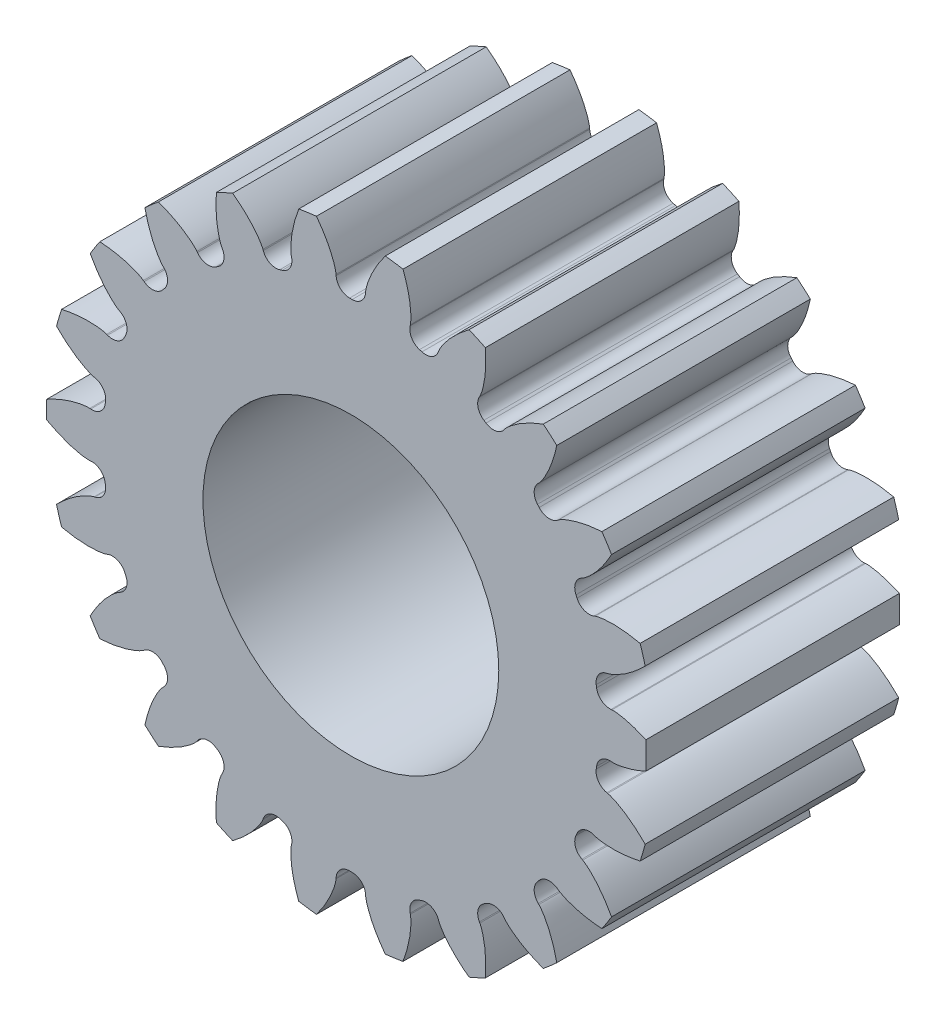
from build123d import *

# Parameters (mm, degrees)
SKETCH1_R           = 17.5
BOSS_EXTRUDE1_DEPTH = 15


with BuildPart() as part:
    # Sketch1 → Boss-Extrude1 (new, symmetric)
    with BuildSketch(Plane.XY):
        with BuildLine():
            Line((-819.999999996, 933.891939604), (-819.999999996, 937.108060409))
            add(Edge.make_bspline(
                [(-819.999999996, 937.108060409), (-820.169210713, 937.18620957), (-820.396536315, 937.28721849), (-820.682528966, 937.407460547), (-821.042316183, 937.547769893), (-821.447510434, 937.689348826), (-821.710754679, 937.774392828), (-821.974540013, 937.852893107), (-822.194762677, 937.912930565), (-822.400539325, 937.965293736), (-822.577110988, 938.006053443), (-822.783274591, 938.049036845), (-822.945371198, 938.079901437), (-823.122277747, 938.109838066), (-823.284458602, 938.132727377), (-823.446614921, 938.149965464), (-823.608736025, 938.164972712), (-823.756009483, 938.177018165), (-823.873604266, 938.180526415), (-823.946961903, 938.177999707), (-824.005559029, 938.17296028)],
                knots=[0, 0, 0, 0, 0, 0, 0.168282354, 0.225425211, 0.282568068, 0.35399664, 0.396853783, 0.425425211, 0.482568068, 0.496853783, 0.55399664, 0.568282354, 0.625425211, 0.639710926, 0.668282354, 0.711139497, 0.725425211, 0.782568068, 0.782568068, 0.782568068, 0.782568068, 0.782568068, 0.782568068], degree=5, weights=[1, 1, 1, 1, 1, 1, 1, 1, 1, 1, 1, 1, 1, 1, 1, 1, 1, 1, 1, 1, 1]))
            Line((-824.005559029, 938.17296028), (-824.119870347, 938.163129363))
            ThreePointArc((-824.119870347, 938.163129363), (-825.246284775, 938.504111809), (-825.828380871, 939.526971833))
            ThreePointArc((-825.828380871, 939.526971833), (-825.849532533, 939.676826658), (-825.871456644, 939.826570421))
            ThreePointArc((-825.871456644, 939.826570421), (-825.601112501, 940.971992849), (-824.616391628, 941.616510727))
            Line((-824.616391628, 941.616510727), (-824.503941032, 941.639283251))
            add(Edge.make_bspline(
                [(-824.503941032, 941.639283251), (-824.446297731, 941.650956674), (-824.375199737, 941.66919955), (-824.277336536, 941.701131741), (-824.153002371, 941.748044847), (-824.0153884, 941.802437657), (-823.878105187, 941.85808966), (-823.741846055, 941.917340589), (-823.579916832, 941.993836635), (-823.419360272, 942.074827636), (-823.233259117, 942.172958266), (-823.048550255, 942.275278574), (-822.852685758, 942.390889117), (-822.658298212, 942.510542894), (-822.414306529, 942.668029809), (-822.147773547, 942.850237651), (-821.871857627, 943.049172255), (-821.550473027, 943.295251308), (-821.222004423, 943.5623757), (-820.910593535, 943.829870846), (-820.615861133, 944.096394198), (-820.383677932, 944.316496637), (-820.222936403, 944.473775473), (-820.120333974, 944.576209821), (-820.074877498, 944.621997763)],
                knots=[0, 0, 0, 0, 0, 0, 0.057142857, 0.071428571, 0.1, 0.128571429, 0.142857143, 0.2, 0.214285714, 0.271428571, 0.3, 0.342857143, 0.4, 0.428571429, 0.485714286, 0.571428571, 0.642857143, 0.714285714, 0.8, 0.871428571, 0.942857143, 1, 1, 1, 1, 1, 1], degree=5, weights=[1, 1, 1, 1, 1, 1, 1, 1, 1, 1, 1, 1, 1, 1, 1, 1, 1, 1, 1, 1, 1, 1, 1, 1, 1]))
            ThreePointArc((-820.074877498, 944.621997763), (-820.358252945, 945.642372053), (-820.67151834, 946.653969862))
            add(Edge.make_bspline(
                [(-820.67151834, 946.653969862), (-820.876252904, 946.699286697), (-821.143709734, 946.754428002), (-821.473693826, 946.815895787), (-821.881249653, 946.881381654), (-822.365326499, 946.943221003), (-822.707760636, 946.978846565), (-823.064446223, 947.007227068), (-823.404017907, 947.024906882), (-823.695923105, 947.032754982), (-823.971138968, 947.033758391), (-824.199355734, 947.029320073), (-824.411549328, 947.021588164), (-824.592451955, 947.010950837), (-824.802374298, 946.994110107), (-824.966600417, 946.978056576), (-825.14477513, 946.956940227), (-825.306835185, 946.933210733), (-825.467279565, 946.904065842), (-825.627061654, 946.872790397), (-825.771763099, 946.842856197), (-825.885582855, 946.81309206), (-825.955257137, 946.790000466), (-826.010060896, 946.768656454)],
                knots=[0, 0, 0, 0, 0, 0, 0.185714286, 0.242857143, 0.3, 0.371428571, 0.442857143, 0.5, 0.571428571, 0.614285714, 0.642857143, 0.7, 0.714285714, 0.771428571, 0.785714286, 0.842857143, 0.857142857, 0.885714286, 0.928571429, 0.942857143, 1, 1, 1, 1, 1, 1], degree=5, weights=[1, 1, 1, 1, 1, 1, 1, 1, 1, 1, 1, 1, 1, 1, 1, 1, 1, 1, 1, 1, 1, 1, 1, 1]))
            Line((-826.010060896, 946.768656454), (-826.116972113, 946.727018538))
            ThreePointArc((-826.116972113, 946.727018538), (-827.293824699, 946.736841182), (-828.140514783, 947.554272767))
            ThreePointArc((-828.140514783, 947.554272767), (-828.203028637, 947.692098306), (-828.266252361, 947.829599659))
            ThreePointArc((-828.266252361, 947.829599659), (-828.329561844, 949.004789177), (-827.566310755, 949.900627482))
            Line((-827.566310755, 949.900627482), (-827.46483096, 949.954158552))
            add(Edge.make_bspline(
                [(-827.46483096, 949.954158552), (-827.412811402, 949.981599114), (-827.349732988, 950.019133645), (-827.264830271, 950.077343608), (-827.158749464, 950.157385386), (-827.042034051, 950.248345241), (-826.925990753, 950.340420097), (-826.811943989, 950.43565958), (-826.678125464, 950.554677734), (-826.546890374, 950.67762204), (-826.395974217, 950.824208444), (-826.247574324, 950.974422561), (-826.09221497, 951.14053147), (-825.93941185, 951.310103728), (-825.749672735, 951.529951717), (-825.545270093, 951.779869881), (-825.336577061, 952.048480733), (-825.097539276, 952.37513636), (-824.857633596, 952.723980637), (-824.634199129, 953.068374936), (-824.426493766, 953.407137933), (-824.265725639, 953.683738243), (-824.155805839, 953.879932303), (-824.086218621, 954.007123785), (-824.055503406, 954.063863562)],
                knots=[0, 0, 0, 0, 0, 0, 0.057142857, 0.071428571, 0.1, 0.128571429, 0.142857143, 0.2, 0.214285714, 0.271428571, 0.3, 0.342857143, 0.4, 0.428571429, 0.485714286, 0.571428571, 0.642857143, 0.714285714, 0.8, 0.871428571, 0.942857143, 1, 1, 1, 1, 1, 1], degree=5, weights=[1, 1, 1, 1, 1, 1, 1, 1, 1, 1, 1, 1, 1, 1, 1, 1, 1, 1, 1, 1, 1, 1, 1, 1, 1]))
            ThreePointArc((-824.055503406, 954.063863562), (-824.614872814, 954.963069435), (-825.200448796, 955.845433365))
            add(Edge.make_bspline(
                [(-825.200448796, 955.845433365), (-825.409657399, 955.831234156), (-825.681815449, 955.808790556), (-826.015750343, 955.774801201), (-826.425246796, 955.722812685), (-826.907137287, 955.645766899), (-827.245737316, 955.58347453), (-827.595970342, 955.510215481), (-827.926767966, 955.431510739), (-828.209060018, 955.356801738), (-828.473410398, 955.280227234), (-828.691132362, 955.211672605), (-828.892552294, 955.144472049), (-829.063130212, 955.08329945), (-829.259804644, 955.007998929), (-829.412855649, 954.946327834), (-829.577863871, 954.875869228), (-829.726673983, 954.807443351), (-829.872408174, 954.734276628), (-830.016906655, 954.659252242), (-830.147313236, 954.589763479), (-830.248136966, 954.529138268), (-830.308483296, 954.487352532), (-830.355053815, 954.451433099)],
                knots=[0, 0, 0, 0, 0, 0, 0.185714286, 0.242857143, 0.3, 0.371428571, 0.442857143, 0.5, 0.571428571, 0.614285714, 0.642857143, 0.7, 0.714285714, 0.771428571, 0.785714286, 0.842857143, 0.857142857, 0.885714286, 0.928571429, 0.942857143, 1, 1, 1, 1, 1, 1], degree=5, weights=[1, 1, 1, 1, 1, 1, 1, 1, 1, 1, 1, 1, 1, 1, 1, 1, 1, 1, 1, 1, 1, 1, 1, 1]))
            Line((-830.355053815, 954.451433099), (-830.44590362, 954.381361441))
            ThreePointArc((-830.44590362, 954.381361441), (-831.577852766, 954.059228511), (-832.620543042, 954.605008211))
            ThreePointArc((-832.620543042, 954.605008211), (-832.719354588, 954.719638659), (-832.818755914, 954.83375806))
            ThreePointArc((-832.818755914, 954.83375806), (-833.210590066, 955.943507802), (-832.730642825, 957.018091042))
            Line((-832.730642825, 957.018091042), (-832.64835512, 957.09804389))
            add(Edge.make_bspline(
                [(-832.64835512, 957.09804389), (-832.606173619, 957.13902852), (-832.556225024, 957.192813882), (-832.491161105, 957.272585791), (-832.41192769, 957.379271732), (-832.325566424, 957.499429606), (-832.24016418, 957.620467957), (-832.157569175, 957.743980259), (-832.062702529, 957.895878377), (-831.971420796, 958.050815772), (-831.867915966, 958.233982392), (-831.767847519, 958.419920862), (-831.665579597, 958.623070982), (-831.566740103, 958.828823986), (-831.446625092, 959.093222272), (-831.320912276, 959.390603873), (-831.196349201, 959.707129719), (-831.05902365, 960.087898225), (-830.927116627, 960.490201099), (-830.809759911, 960.883593772), (-830.70590864, 961.26715185), (-830.629580065, 961.57784152), (-830.579387043, 961.797056328), (-830.548452578, 961.938700647), (-830.534966987, 962.00179554)],
                knots=[0, 0, 0, 0, 0, 0, 0.057142857, 0.071428571, 0.1, 0.128571429, 0.142857143, 0.2, 0.214285714, 0.271428571, 0.3, 0.342857143, 0.4, 0.428571429, 0.485714286, 0.571428571, 0.642857143, 0.714285714, 0.8, 0.871428571, 0.942857143, 1, 1, 1, 1, 1, 1], degree=5, weights=[1, 1, 1, 1, 1, 1, 1, 1, 1, 1, 1, 1, 1, 1, 1, 1, 1, 1, 1, 1, 1, 1, 1, 1, 1]))
            ThreePointArc((-830.534966987, 962.00179554), (-831.325013574, 962.706984683), (-832.13546026, 963.388630855))
            add(Edge.make_bspline(
                [(-832.13546026, 963.388630855), (-832.332194066, 963.31606594), (-832.587004709, 963.217855679), (-832.897836986, 963.091162801), (-833.276099098, 962.925911702), (-833.716763331, 962.716222572), (-834.024097892, 962.561058829), (-834.33950456, 962.392095241), (-834.634728868, 962.223382134), (-834.884538151, 962.072168511), (-835.116606951, 961.924219703), (-835.306195575, 961.797102654), (-835.480524, 961.67587764), (-835.626958002, 961.569125607), (-835.794451129, 961.441465696), (-835.923927737, 961.339173263), (-836.062401484, 961.225080537), (-836.185905944, 961.117501736), (-836.305123428, 961.006240713), (-836.422631893, 960.893545415), (-836.528178845, 960.790131656), (-836.607838409, 960.703556864), (-836.653967886, 960.646462219), (-836.688532298, 960.598877344)],
                knots=[0, 0, 0, 0, 0, 0, 0.185714286, 0.242857143, 0.3, 0.371428571, 0.442857143, 0.5, 0.571428571, 0.614285714, 0.642857143, 0.7, 0.714285714, 0.771428571, 0.785714286, 0.842857143, 0.857142857, 0.885714286, 0.928571429, 0.942857143, 1, 1, 1, 1, 1, 1], degree=5, weights=[1, 1, 1, 1, 1, 1, 1, 1, 1, 1, 1, 1, 1, 1, 1, 1, 1, 1, 1, 1, 1, 1, 1, 1]))
            Line((-836.688532298, 960.598877344), (-836.75596058, 960.506048732))
            ThreePointArc((-836.75596058, 960.506048732), (-837.751302498, 959.878057522), (-838.905520403, 960.107969512))
            ThreePointArc((-838.905520403, 960.107969512), (-839.032624516, 960.190118192), (-839.160150541, 960.271610365))
            ThreePointArc((-839.160150541, 960.271610365), (-839.848765289, 961.226015008), (-839.691004367, 962.39228684))
            Line((-839.691004367, 962.39228684), (-839.634575212, 962.492184162))
            add(Edge.make_bspline(
                [(-839.634575212, 962.492184162), (-839.605649063, 962.543392528), (-839.572876824, 962.60907135), (-839.532922796, 962.703942561), (-839.486955794, 962.828629604), (-839.437945151, 962.96825102), (-839.390102742, 963.10844706), (-839.345650851, 963.250225948), (-839.297421616, 963.422698147), (-839.253488343, 963.597076525), (-839.205780186, 963.80198429), (-839.162150135, 964.008583486), (-839.121258785, 964.232316801), (-839.084390305, 964.457581666), (-839.043630401, 964.745110274), (-839.006791916, 965.065863223), (-838.976450157, 965.404661022), (-838.951962141, 965.808694807), (-838.938740096, 966.23186409), (-838.936968675, 966.642384803), (-838.945384909, 967.039664369), (-838.959679572, 967.359273168), (-838.973279669, 967.583749245), (-838.983504083, 967.728371219), (-838.988340639, 967.792709656)],
                knots=[0, 0, 0, 0, 0, 0, 0.057142857, 0.071428571, 0.1, 0.128571429, 0.142857143, 0.2, 0.214285714, 0.271428571, 0.3, 0.342857143, 0.4, 0.428571429, 0.485714286, 0.571428571, 0.642857143, 0.714285714, 0.8, 0.871428571, 0.942857143, 1, 1, 1, 1, 1, 1], degree=5, weights=[1, 1, 1, 1, 1, 1, 1, 1, 1, 1, 1, 1, 1, 1, 1, 1, 1, 1, 1, 1, 1, 1, 1, 1, 1]))
            ThreePointArc((-838.988340639, 967.792709656), (-839.945059527, 968.246751839), (-840.914719348, 968.672457335))
            add(Edge.make_bspline(
                [(-840.914719348, 968.672457335), (-841.083040153, 968.54740549), (-841.299860147, 968.381384981), (-841.562408024, 968.172252482), (-841.878791247, 967.907126462), (-842.242529229, 967.581781754), (-842.493699902, 967.346317082), (-842.74872784, 967.095337379), (-842.984461514, 966.850284039), (-843.181549965, 966.634816222), (-843.362536353, 966.427479044), (-843.508632294, 966.25209784), (-843.64174616, 966.086669298), (-843.752173032, 965.942986248), (-843.876915558, 965.773309193), (-843.972328345, 965.638682546), (-844.073049296, 965.490198815), (-844.161242508, 965.352182484), (-844.244284993, 965.211840867), (-844.325283606, 965.07060456), (-844.397420141, 964.941643772), (-844.449461996, 964.836133176), (-844.477637485, 964.768355089), (-844.497395587, 964.712959815)],
                knots=[0, 0, 0, 0, 0, 0, 0.185714286, 0.242857143, 0.3, 0.371428571, 0.442857143, 0.5, 0.571428571, 0.614285714, 0.642857143, 0.7, 0.714285714, 0.771428571, 0.785714286, 0.842857143, 0.857142857, 0.885714286, 0.928571429, 0.942857143, 1, 1, 1, 1, 1, 1], degree=5, weights=[1, 1, 1, 1, 1, 1, 1, 1, 1, 1, 1, 1, 1, 1, 1, 1, 1, 1, 1, 1, 1, 1, 1, 1]))
            Line((-844.497395587, 964.712959815), (-844.535939708, 964.604894673))
            ThreePointArc((-844.535939708, 964.604894673), (-845.314037715, 963.721921295), (-846.486275377, 963.617339473))
            ThreePointArc((-846.486275377, 963.617339473), (-846.631374838, 963.660351188), (-846.776694161, 963.702614122))
            ThreePointArc((-846.776694161, 963.702614122), (-847.706302034, 964.424353477), (-847.883508283, 965.587829493))
            Line((-847.883508283, 965.587829493), (-847.857509234, 965.699578201))
            add(Edge.make_bspline(
                [(-847.857509234, 965.699578201), (-847.844181861, 965.756861707), (-847.83124099, 965.829113082), (-847.819633689, 965.931397692), (-847.810657073, 966.063984435), (-847.802967604, 966.211758097), (-847.796560938, 966.359753977), (-847.79385339, 966.508313368), (-847.796168811, 966.687386977), (-847.803143211, 966.867079239), (-847.815096758, 967.077127741), (-847.83143975, 967.287650223), (-847.855237746, 967.513841191), (-847.883327145, 967.740368298), (-847.925224474, 968.027733368), (-847.980244755, 968.34587217), (-848.04658242, 968.679494539), (-848.136915812, 969.074061188), (-848.243449916, 969.483814223), (-848.357407301, 969.878205029), (-848.477409206, 970.257020854), (-848.581169039, 970.559655979), (-848.657460455, 970.771207608), (-848.708015427, 970.907090826), (-848.730782301, 970.967460488)],
                knots=[0, 0, 0, 0, 0, 0, 0.057142857, 0.071428571, 0.1, 0.128571429, 0.142857143, 0.2, 0.214285714, 0.271428571, 0.3, 0.342857143, 0.4, 0.428571429, 0.485714286, 0.571428571, 0.642857143, 0.714285714, 0.8, 0.871428571, 0.942857143, 1, 1, 1, 1, 1, 1], degree=5, weights=[1, 1, 1, 1, 1, 1, 1, 1, 1, 1, 1, 1, 1, 1, 1, 1, 1, 1, 1, 1, 1, 1, 1, 1, 1]))
            ThreePointArc((-848.730782301, 970.967460488), (-849.776665818, 971.133571914), (-850.8269827, 971.268848606))
            add(Edge.make_bspline(
                [(-850.8269827, 971.268848606), (-850.953254154, 971.101440789), (-851.114518032, 970.881060025), (-851.307511441, 970.606430578), (-851.53638429, 970.26290857), (-851.793728131, 969.848265777), (-851.968386563, 969.551576122), (-852.142374924, 969.238913187), (-852.299520224, 968.937372379), (-852.427920909, 968.675106289), (-852.543162443, 968.425177966), (-852.633929877, 968.21574095), (-852.71504509, 968.019510917), (-852.780518705, 967.850537194), (-852.852404731, 967.652589222), (-852.906023921, 967.496535012), (-852.960832264, 967.325689543), (-853.006569337, 967.168416945), (-853.046709216, 967.010364378), (-853.08463595, 966.852029188), (-853.117517996, 966.707969007), (-853.13772602, 966.592070446), (-853.14566491, 966.519099896), (-853.149016018, 966.460382019)],
                knots=[0, 0, 0, 0, 0, 0, 0.185714286, 0.242857143, 0.3, 0.371428571, 0.442857143, 0.5, 0.571428571, 0.614285714, 0.642857143, 0.7, 0.714285714, 0.771428571, 0.785714286, 0.842857143, 0.857142857, 0.885714286, 0.928571429, 0.942857143, 1, 1, 1, 1, 1, 1], degree=5, weights=[1, 1, 1, 1, 1, 1, 1, 1, 1, 1, 1, 1, 1, 1, 1, 1, 1, 1, 1, 1, 1, 1, 1, 1]))
            Line((-853.149016018, 966.460382019), (-853.155553362, 966.34583514))
            ThreePointArc((-853.155553362, 966.34583514), (-853.653370586, 965.279412848), (-854.748660282, 964.848809811))
            ThreePointArc((-854.748660282, 964.848809811), (-854.899999996, 964.849200006), (-855.05133971, 964.848809811))
            ThreePointArc((-855.05133971, 964.848809811), (-856.146629405, 965.279412848), (-856.644446629, 966.34583514))
            Line((-856.644446629, 966.34583514), (-856.650983973, 966.460382019))
            add(Edge.make_bspline(
                [(-856.650983973, 966.460382019), (-856.654335081, 966.519099896), (-856.662273971, 966.592070446), (-856.679953752, 966.693481966), (-856.708694754, 966.823227019), (-856.742949414, 966.967181183), (-856.778497521, 967.110987156), (-856.817753665, 967.254291653), (-856.870426161, 967.425459193), (-856.927743209, 967.59590774), (-856.998390055, 967.794080098), (-857.073382078, 967.991470588), (-857.159941448, 968.201794563), (-857.25071309, 968.411232031), (-857.371873378, 968.675152956), (-857.514295009, 968.964903897), (-857.671937816, 969.266322736), (-857.869774341, 969.619456805), (-858.087433836, 969.982597837), (-858.307887877, 970.32890754), (-858.529753612, 970.658570218), (-858.71457261, 970.919713972), (-858.847374669, 971.101202496), (-858.934164536, 971.217338508), (-858.973017291, 971.268848606)],
                knots=[0, 0, 0, 0, 0, 0, 0.057142857, 0.071428571, 0.1, 0.128571429, 0.142857143, 0.2, 0.214285714, 0.271428571, 0.3, 0.342857143, 0.4, 0.428571429, 0.485714286, 0.571428571, 0.642857143, 0.714285714, 0.8, 0.871428571, 0.942857143, 1, 1, 1, 1, 1, 1], degree=5, weights=[1, 1, 1, 1, 1, 1, 1, 1, 1, 1, 1, 1, 1, 1, 1, 1, 1, 1, 1, 1, 1, 1, 1, 1, 1]))
            ThreePointArc((-858.973017291, 971.268848606), (-860.023334173, 971.133571914), (-861.06921769, 970.967460488))
            add(Edge.make_bspline(
                [(-861.06921769, 970.967460488), (-861.143210031, 970.771259085), (-861.235853153, 970.514372006), (-861.343656916, 970.196494454), (-861.466477473, 969.802406568), (-861.596578706, 969.332057583), (-861.680575109, 968.998178978), (-861.759428391, 968.649162903), (-861.82525434, 968.315563669), (-861.874564998, 968.027746546), (-861.914725495, 967.755474784), (-861.942810985, 967.528949297), (-861.965356072, 967.317815163), (-861.980572147, 967.137240014), (-861.993777895, 966.927057692), (-862.00125958, 966.762218502), (-862.005715069, 966.582852181), (-862.005290658, 966.419064605), (-861.999276036, 966.256105567), (-861.991058293, 966.093498868), (-861.982021942, 965.946010195), (-861.968759001, 965.829113082), (-861.95581813, 965.756861707), (-861.942490758, 965.699578201)],
                knots=[0, 0, 0, 0, 0, 0, 0.185714286, 0.242857143, 0.3, 0.371428571, 0.442857143, 0.5, 0.571428571, 0.614285714, 0.642857143, 0.7, 0.714285714, 0.771428571, 0.785714286, 0.842857143, 0.857142857, 0.885714286, 0.928571429, 0.942857143, 1, 1, 1, 1, 1, 1], degree=5, weights=[1, 1, 1, 1, 1, 1, 1, 1, 1, 1, 1, 1, 1, 1, 1, 1, 1, 1, 1, 1, 1, 1, 1, 1]))
            Line((-861.942490758, 965.699578201), (-861.916491708, 965.587829493))
            ThreePointArc((-861.916491708, 965.587829493), (-862.093697957, 964.424353477), (-863.02330583, 963.702614122))
            ThreePointArc((-863.02330583, 963.702614122), (-863.168625153, 963.660351188), (-863.313724614, 963.617339473))
            ThreePointArc((-863.313724614, 963.617339473), (-864.485962276, 963.721921295), (-865.264060283, 964.604894673))
            Line((-865.264060283, 964.604894673), (-865.302604404, 964.712959815))
            add(Edge.make_bspline(
                [(-865.302604404, 964.712959815), (-865.322362506, 964.768355089), (-865.350537995, 964.836133176), (-865.396072548, 964.928455847), (-865.460202743, 965.044848037), (-865.533626423, 965.173320393), (-865.608249406, 965.301286155), (-865.686288943, 965.427726079), (-865.785051301, 965.577120574), (-865.888067511, 965.724516679), (-866.011684269, 965.894758147), (-866.139249915, 966.063025241), (-866.281558134, 966.240443024), (-866.427658239, 966.415823477), (-866.618265802, 966.634918952), (-866.83655063, 966.872808133), (-867.072727295, 967.11760428), (-867.362039415, 967.400696949), (-867.673190823, 967.687806451), (-867.982281644, 967.957979097), (-868.288036967, 968.21178132), (-868.538942195, 968.410277388), (-868.717496064, 968.546999688), (-868.833489626, 968.633979844), (-868.885280643, 968.672457335)],
                knots=[0, 0, 0, 0, 0, 0, 0.057142857, 0.071428571, 0.1, 0.128571429, 0.142857143, 0.2, 0.214285714, 0.271428571, 0.3, 0.342857143, 0.4, 0.428571429, 0.485714286, 0.571428571, 0.642857143, 0.714285714, 0.8, 0.871428571, 0.942857143, 1, 1, 1, 1, 1, 1], degree=5, weights=[1, 1, 1, 1, 1, 1, 1, 1, 1, 1, 1, 1, 1, 1, 1, 1, 1, 1, 1, 1, 1, 1, 1, 1, 1]))
            ThreePointArc((-868.885280643, 968.672457335), (-869.854940464, 968.246751839), (-870.811659352, 967.792709656))
            add(Edge.make_bspline(
                [(-870.811659352, 967.792709656), (-870.82737816, 967.583609736), (-870.843895131, 967.311027806), (-870.85777563, 966.975654698), (-870.864593703, 966.562927591), (-870.8569123, 966.074977292), (-870.843441785, 965.730958595), (-870.820771764, 965.373864586), (-870.789945534, 965.035233153), (-870.756171311, 964.745182227), (-870.717997205, 964.472624865), (-870.681125431, 964.247362656), (-870.643273924, 964.038429252), (-870.606999742, 963.860881802), (-870.560455362, 963.655492851), (-870.521193419, 963.495222973), (-870.474935098, 963.321866992), (-870.428383586, 963.164833534), (-870.376701732, 963.010169997), (-870.323005264, 962.856465218), (-870.272782588, 962.717496706), (-870.227123167, 962.60907135), (-870.194350928, 962.543392528), (-870.165424779, 962.492184162)],
                knots=[0, 0, 0, 0, 0, 0, 0.185714286, 0.242857143, 0.3, 0.371428571, 0.442857143, 0.5, 0.571428571, 0.614285714, 0.642857143, 0.7, 0.714285714, 0.771428571, 0.785714286, 0.842857143, 0.857142857, 0.885714286, 0.928571429, 0.942857143, 1, 1, 1, 1, 1, 1], degree=5, weights=[1, 1, 1, 1, 1, 1, 1, 1, 1, 1, 1, 1, 1, 1, 1, 1, 1, 1, 1, 1, 1, 1, 1, 1]))
            Line((-870.165424779, 962.492184162), (-870.108995624, 962.39228684))
            ThreePointArc((-870.108995624, 962.39228684), (-869.951234702, 961.226015008), (-870.63984945, 960.271610365))
            ThreePointArc((-870.63984945, 960.271610365), (-870.767375475, 960.190118192), (-870.894479589, 960.107969512))
            ThreePointArc((-870.894479589, 960.107969512), (-872.048697493, 959.878057522), (-873.044039411, 960.506048732))
            Line((-873.044039411, 960.506048732), (-873.111467693, 960.598877344))
            add(Edge.make_bspline(
                [(-873.111467693, 960.598877344), (-873.146032105, 960.646462219), (-873.192161582, 960.703556864), (-873.261861968, 960.779311252), (-873.356185909, 960.872921178), (-873.462830259, 960.975503659), (-873.570482609, 961.077262185), (-873.680983238, 961.176594125), (-873.81783432, 961.292112522), (-873.958203931, 961.404515028), (-874.124775906, 961.533033656), (-874.294580566, 961.658545354), (-874.481108668, 961.788683613), (-874.670701076, 961.915798769), (-874.915314021, 962.072318981), (-875.191777907, 962.239074037), (-875.487354803, 962.407415564), (-875.84470417, 962.597532347), (-876.224139854, 962.785350415), (-876.596826755, 962.957498223), (-876.961701188, 963.114878444), (-877.258365796, 963.234645855), (-877.468206102, 963.315525504), (-877.604006252, 963.366303189), (-877.664539731, 963.388630855)],
                knots=[0, 0, 0, 0, 0, 0, 0.057142857, 0.071428571, 0.1, 0.128571429, 0.142857143, 0.2, 0.214285714, 0.271428571, 0.3, 0.342857143, 0.4, 0.428571429, 0.485714286, 0.571428571, 0.642857143, 0.714285714, 0.8, 0.871428571, 0.942857143, 1, 1, 1, 1, 1, 1], degree=5, weights=[1, 1, 1, 1, 1, 1, 1, 1, 1, 1, 1, 1, 1, 1, 1, 1, 1, 1, 1, 1, 1, 1, 1, 1, 1]))
            ThreePointArc((-877.664539731, 963.388630855), (-878.474986418, 962.706984683), (-879.265033004, 962.00179554))
            add(Edge.make_bspline(
                [(-879.265033004, 962.00179554), (-879.221204834, 961.796737136), (-879.160257548, 961.530543321), (-879.079090265, 961.204844592), (-878.969353496, 960.80691496), (-878.824511758, 960.340894178), (-878.714665627, 960.014605737), (-878.592308893, 959.678363428), (-878.467327842, 959.3621337), (-878.353204923, 959.093347173), (-878.239788855, 958.842585187), (-878.140946948, 958.63683566), (-878.045765351, 958.447029529), (-877.960939632, 958.286893616), (-877.858415872, 958.102937428), (-877.775591071, 957.960220973), (-877.682366513, 957.806919602), (-877.593459226, 957.66936218), (-877.500297097, 957.535524064), (-877.405472073, 957.403173451), (-877.318131814, 957.283983504), (-877.243774967, 957.192813882), (-877.193826372, 957.13902852), (-877.151644871, 957.09804389)],
                knots=[0, 0, 0, 0, 0, 0, 0.185714286, 0.242857143, 0.3, 0.371428571, 0.442857143, 0.5, 0.571428571, 0.614285714, 0.642857143, 0.7, 0.714285714, 0.771428571, 0.785714286, 0.842857143, 0.857142857, 0.885714286, 0.928571429, 0.942857143, 1, 1, 1, 1, 1, 1], degree=5, weights=[1, 1, 1, 1, 1, 1, 1, 1, 1, 1, 1, 1, 1, 1, 1, 1, 1, 1, 1, 1, 1, 1, 1, 1]))
            Line((-877.151644871, 957.09804389), (-877.069357166, 957.018091042))
            ThreePointArc((-877.069357166, 957.018091042), (-876.589409925, 955.943507802), (-876.981244077, 954.83375806))
            ThreePointArc((-876.981244077, 954.83375806), (-877.080645403, 954.719638659), (-877.179456949, 954.605008211))
            ThreePointArc((-877.179456949, 954.605008211), (-878.222147225, 954.059228511), (-879.354096371, 954.381361441))
            Line((-879.354096371, 954.381361441), (-879.444946176, 954.451433099))
            add(Edge.make_bspline(
                [(-879.444946176, 954.451433099), (-879.491516695, 954.487352532), (-879.551863025, 954.529138268), (-879.640082533, 954.582187203), (-879.756958655, 954.645431144), (-879.888183985, 954.713813128), (-880.020144347, 954.781120547), (-880.154153967, 954.845297221), (-880.318006912, 954.917580905), (-880.484358013, 954.985883631), (-880.680390533, 955.062267603), (-880.878677643, 955.134855695), (-881.09431423, 955.2071714), (-881.312039292, 955.275723145), (-881.590840534, 955.356987759), (-881.903086018, 955.439099186), (-882.234117261, 955.517348064), (-882.630553556, 955.59908683), (-883.047533893, 955.672397562), (-883.453623998, 955.73257414), (-883.848057585, 955.780782349), (-884.166447571, 955.81211826), (-884.3905743, 955.830602869), (-884.535179317, 955.841064378), (-884.599551195, 955.845433365)],
                knots=[0, 0, 0, 0, 0, 0, 0.057142857, 0.071428571, 0.1, 0.128571429, 0.142857143, 0.2, 0.214285714, 0.271428571, 0.3, 0.342857143, 0.4, 0.428571429, 0.485714286, 0.571428571, 0.642857143, 0.714285714, 0.8, 0.871428571, 0.942857143, 1, 1, 1, 1, 1, 1], degree=5, weights=[1, 1, 1, 1, 1, 1, 1, 1, 1, 1, 1, 1, 1, 1, 1, 1, 1, 1, 1, 1, 1, 1, 1, 1, 1]))
            ThreePointArc((-884.599551195, 955.845433365), (-885.185127177, 954.963069435), (-885.744496585, 954.063863562))
            add(Edge.make_bspline(
                [(-885.744496585, 954.063863562), (-885.644672136, 953.879459287), (-885.511198179, 953.641219026), (-885.341558806, 953.351580851), (-885.124157414, 953.000686585), (-884.853889558, 952.594349552), (-884.65656689, 952.312225318), (-884.444436058, 952.02407506), (-884.235425408, 951.755866089), (-884.050199354, 951.530119446), (-883.870729618, 951.321468082), (-883.717925162, 951.151899839), (-883.573124523, 950.996597945), (-883.446619341, 950.866846828), (-883.296422066, 950.71922644), (-883.17674438, 950.605625447), (-883.044106084, 950.484798252), (-882.920045763, 950.377860949), (-882.7929508, 950.275691021), (-882.664679379, 950.175416835), (-882.547297326, 950.085661513), (-882.450267003, 950.019133645), (-882.387188589, 949.981599114), (-882.335169031, 949.954158552)],
                knots=[0, 0, 0, 0, 0, 0, 0.185714286, 0.242857143, 0.3, 0.371428571, 0.442857143, 0.5, 0.571428571, 0.614285714, 0.642857143, 0.7, 0.714285714, 0.771428571, 0.785714286, 0.842857143, 0.857142857, 0.885714286, 0.928571429, 0.942857143, 1, 1, 1, 1, 1, 1], degree=5, weights=[1, 1, 1, 1, 1, 1, 1, 1, 1, 1, 1, 1, 1, 1, 1, 1, 1, 1, 1, 1, 1, 1, 1, 1]))
            Line((-882.335169031, 949.954158552), (-882.233689236, 949.900627482))
            ThreePointArc((-882.233689236, 949.900627482), (-881.470438147, 949.004789177), (-881.53374763, 947.829599659))
            ThreePointArc((-881.53374763, 947.829599659), (-881.596971354, 947.692098306), (-881.659485208, 947.554272767))
            ThreePointArc((-881.659485208, 947.554272767), (-882.506175292, 946.736841182), (-883.683027878, 946.727018538))
            Line((-883.683027878, 946.727018538), (-883.789939095, 946.768656454))
            add(Edge.make_bspline(
                [(-883.789939095, 946.768656454), (-883.844742854, 946.790000466), (-883.914417136, 946.81309206), (-884.014008746, 946.839137833), (-884.143968441, 946.866892141), (-884.289143654, 946.895533727), (-884.434721386, 946.922937192), (-884.581383333, 946.946759387), (-884.758963749, 946.969952365), (-884.937819563, 946.98862183), (-885.147431241, 947.006682971), (-885.358136759, 947.0204668), (-885.585412237, 947.029101364), (-885.813631163, 947.033536044), (-886.104033883, 947.032961483), (-886.426764693, 947.023777101), (-886.766432101, 947.005594071), (-887.169838412, 946.972332832), (-887.590582136, 946.925197028), (-887.997176439, 946.868527229), (-888.389214517, 946.803657884), (-888.703535817, 946.744023645), (-888.923791555, 946.698615701), (-889.065486401, 946.667913504), (-889.128481651, 946.653969862)],
                knots=[0, 0, 0, 0, 0, 0, 0.057142857, 0.071428571, 0.1, 0.128571429, 0.142857143, 0.2, 0.214285714, 0.271428571, 0.3, 0.342857143, 0.4, 0.428571429, 0.485714286, 0.571428571, 0.642857143, 0.714285714, 0.8, 0.871428571, 0.942857143, 1, 1, 1, 1, 1, 1], degree=5, weights=[1, 1, 1, 1, 1, 1, 1, 1, 1, 1, 1, 1, 1, 1, 1, 1, 1, 1, 1, 1, 1, 1, 1, 1, 1]))
            ThreePointArc((-889.128481651, 946.653969862), (-889.441747046, 945.642372053), (-889.725122493, 944.621997763))
            add(Edge.make_bspline(
                [(-889.725122493, 944.621997763), (-889.577388947, 944.473186953), (-889.382201585, 944.282201056), (-889.137833295, 944.052088196), (-888.830379848, 943.776656664), (-888.456581368, 943.46292239), (-888.187768073, 943.247818389), (-887.903048722, 943.031104403), (-887.626941272, 942.832644885), (-887.385617996, 942.668226778), (-887.154634163, 942.518589727), (-886.960246467, 942.39894018), (-886.77755767, 942.290724157), (-886.619621723, 942.201869502), (-886.433919024, 942.102544238), (-886.287084027, 942.027261984), (-886.12577756, 941.948697665), (-885.976614834, 941.881043906), (-885.825883515, 941.818819368), (-885.674557485, 941.758745226), (-885.536643233, 941.70569597), (-885.424800254, 941.66919955), (-885.35370226, 941.650956674), (-885.296058959, 941.639283251)],
                knots=[0, 0, 0, 0, 0, 0, 0.185714286, 0.242857143, 0.3, 0.371428571, 0.442857143, 0.5, 0.571428571, 0.614285714, 0.642857143, 0.7, 0.714285714, 0.771428571, 0.785714286, 0.842857143, 0.857142857, 0.885714286, 0.928571429, 0.942857143, 1, 1, 1, 1, 1, 1], degree=5, weights=[1, 1, 1, 1, 1, 1, 1, 1, 1, 1, 1, 1, 1, 1, 1, 1, 1, 1, 1, 1, 1, 1, 1, 1]))
            Line((-885.296058959, 941.639283251), (-885.183608363, 941.616510727))
            ThreePointArc((-885.183608363, 941.616510727), (-884.19888749, 940.971992849), (-883.928543347, 939.826570421))
            ThreePointArc((-883.928543347, 939.826570421), (-883.950467458, 939.676826658), (-883.97161912, 939.526971833))
            ThreePointArc((-883.97161912, 939.526971833), (-884.553715216, 938.504111809), (-885.680129644, 938.163129363))
            Line((-885.680129644, 938.163129363), (-885.794440962, 938.17296028))
            add(Edge.make_bspline(
                [(-885.794440962, 938.17296028), (-885.853038088, 938.177999707), (-885.926395725, 938.180526415), (-886.029291117, 938.177458953), (-886.161805824, 938.167475139), (-886.309169688, 938.154055955), (-886.456570947, 938.139335401), (-886.604003543, 938.120873185), (-886.780924921, 938.093096499), (-886.957795614, 938.060620214), (-887.164004958, 938.018895318), (-887.370058775, 937.972758201), (-887.590560638, 937.917012103), (-887.810784486, 937.856970445), (-888.089261983, 937.774603258), (-888.396332389, 937.674867131), (-888.717118129, 937.561725274), (-889.094812876, 937.416158658), (-889.485233832, 937.25239498), (-889.859392482, 937.083469853), (-890.217274456, 936.910778282), (-890.502062628, 936.765005106), (-890.700603565, 936.65938329), (-890.827908966, 936.590004696), (-890.884424088, 936.558878058)],
                knots=[0, 0, 0, 0, 0, 0, 0.057142857, 0.071428571, 0.1, 0.128571429, 0.142857143, 0.2, 0.214285714, 0.271428571, 0.3, 0.342857143, 0.4, 0.428571429, 0.485714286, 0.571428571, 0.642857143, 0.714285714, 0.8, 0.871428571, 0.942857143, 1, 1, 1, 1, 1, 1], degree=5, weights=[1, 1, 1, 1, 1, 1, 1, 1, 1, 1, 1, 1, 1, 1, 1, 1, 1, 1, 1, 1, 1, 1, 1, 1, 1]))
            ThreePointArc((-890.884424088, 936.558878058), (-890.899999996, 935.500000006), (-890.884424088, 934.441121955))
            add(Edge.make_bspline(
                [(-890.884424088, 934.441121955), (-890.70074994, 934.339960379), (-890.459662092, 934.211701387), (-890.16036215, 934.059756218), (-889.787764699, 933.882101244), (-889.340718524, 933.686386614), (-889.022192256, 933.555729294), (-888.687950654, 933.428008458), (-888.367114988, 933.315376402), (-888.089245066, 933.225607007), (-887.825460073, 933.147106974), (-887.605237271, 933.087069417), (-887.399460678, 933.034706286), (-887.222888998, 932.993946566), (-887.016725402, 932.950963169), (-886.854628792, 932.920098575), (-886.677722244, 932.890161947), (-886.51554139, 932.867272636), (-886.35338507, 932.850034549), (-886.191263966, 932.835027301), (-886.043990508, 932.822981848), (-885.926395725, 932.819473598), (-885.853038088, 932.822000306), (-885.794440962, 932.827039733)],
                knots=[0, 0, 0, 0, 0, 0, 0.185714286, 0.242857143, 0.3, 0.371428571, 0.442857143, 0.5, 0.571428571, 0.614285714, 0.642857143, 0.7, 0.714285714, 0.771428571, 0.785714286, 0.842857143, 0.857142857, 0.885714286, 0.928571429, 0.942857143, 1, 1, 1, 1, 1, 1], degree=5, weights=[1, 1, 1, 1, 1, 1, 1, 1, 1, 1, 1, 1, 1, 1, 1, 1, 1, 1, 1, 1, 1, 1, 1, 1]))
            Line((-885.794440962, 932.827039733), (-885.680129644, 932.83687065))
            ThreePointArc((-885.680129644, 932.83687065), (-884.553715216, 932.495888204), (-883.97161912, 931.473028179))
            ThreePointArc((-883.97161912, 931.473028179), (-883.950467458, 931.323173355), (-883.928543347, 931.173429592))
            ThreePointArc((-883.928543347, 931.173429592), (-884.19888749, 930.028007164), (-885.183608363, 929.383489286))
            Line((-885.183608363, 929.383489286), (-885.296058959, 929.360716762))
            add(Edge.make_bspline(
                [(-885.296058959, 929.360716762), (-885.35370226, 929.349043338), (-885.424800254, 929.330800463), (-885.522663455, 929.298868272), (-885.64699762, 929.251955166), (-885.784611591, 929.197562355), (-885.921894804, 929.141910353), (-886.058153936, 929.082659424), (-886.220083159, 929.006163377), (-886.38063972, 928.925172377), (-886.566740874, 928.827041747), (-886.751449736, 928.724721439), (-886.947314233, 928.609110896), (-887.141701779, 928.489457119), (-887.385693462, 928.331970204), (-887.652226445, 928.149762362), (-887.928142364, 927.950827758), (-888.249526964, 927.704748705), (-888.577995568, 927.437624313), (-888.889406456, 927.170129167), (-889.184138858, 926.903605815), (-889.416322059, 926.683503376), (-889.577063589, 926.52622454), (-889.679666017, 926.423790192), (-889.725122493, 926.37800225)],
                knots=[0, 0, 0, 0, 0, 0, 0.057142857, 0.071428571, 0.1, 0.128571429, 0.142857143, 0.2, 0.214285714, 0.271428571, 0.3, 0.342857143, 0.4, 0.428571429, 0.485714286, 0.571428571, 0.642857143, 0.714285714, 0.8, 0.871428571, 0.942857143, 1, 1, 1, 1, 1, 1], degree=5, weights=[1, 1, 1, 1, 1, 1, 1, 1, 1, 1, 1, 1, 1, 1, 1, 1, 1, 1, 1, 1, 1, 1, 1, 1, 1]))
            ThreePointArc((-889.725122493, 926.37800225), (-889.441747046, 925.35762796), (-889.128481651, 924.34603015))
            add(Edge.make_bspline(
                [(-889.128481651, 924.34603015), (-888.923747087, 924.300713316), (-888.656290257, 924.245572011), (-888.326306165, 924.184104226), (-887.918750338, 924.118618359), (-887.434673492, 924.056779009), (-887.092239355, 924.021153448), (-886.735553768, 923.992772945), (-886.395982085, 923.975093131), (-886.104076886, 923.967245031), (-885.828861023, 923.966241622), (-885.600644258, 923.97067994), (-885.388450664, 923.978411849), (-885.207548036, 923.989049175), (-884.997625693, 924.005889906), (-884.833399574, 924.021943437), (-884.655224861, 924.043059786), (-884.493164807, 924.06678928), (-884.332720427, 924.095934171), (-884.172938337, 924.127209616), (-884.028236892, 924.157143816), (-883.914417136, 924.186907953), (-883.844742854, 924.209999547), (-883.789939095, 924.231343559)],
                knots=[0, 0, 0, 0, 0, 0, 0.185714286, 0.242857143, 0.3, 0.371428571, 0.442857143, 0.5, 0.571428571, 0.614285714, 0.642857143, 0.7, 0.714285714, 0.771428571, 0.785714286, 0.842857143, 0.857142857, 0.885714286, 0.928571429, 0.942857143, 1, 1, 1, 1, 1, 1], degree=5, weights=[1, 1, 1, 1, 1, 1, 1, 1, 1, 1, 1, 1, 1, 1, 1, 1, 1, 1, 1, 1, 1, 1, 1, 1]))
            Line((-883.789939095, 924.231343559), (-883.683027878, 924.272981475))
            ThreePointArc((-883.683027878, 924.272981475), (-882.506175292, 924.263158831), (-881.659485208, 923.445727246))
            ThreePointArc((-881.659485208, 923.445727246), (-881.596971354, 923.307901707), (-881.53374763, 923.170400354))
            ThreePointArc((-881.53374763, 923.170400354), (-881.470438147, 921.995210836), (-882.233689236, 921.099372531))
            Line((-882.233689236, 921.099372531), (-882.335169031, 921.045841461))
            add(Edge.make_bspline(
                [(-882.335169031, 921.045841461), (-882.387188589, 921.018400898), (-882.450267003, 920.980866368), (-882.53516972, 920.922656405), (-882.641250527, 920.842614627), (-882.757965941, 920.751654772), (-882.874009238, 920.659579916), (-882.988056002, 920.564340432), (-883.121874527, 920.445322279), (-883.253109617, 920.322377973), (-883.404025774, 920.175791568), (-883.552425667, 920.025577452), (-883.707785022, 919.859468543), (-883.860588141, 919.689896285), (-884.050327256, 919.470048295), (-884.254729898, 919.220130132), (-884.46342293, 918.95151928), (-884.702460715, 918.624863653), (-884.942366395, 918.276019376), (-885.165800862, 917.931625077), (-885.373506226, 917.59286208), (-885.534274352, 917.31626177), (-885.644194152, 917.12006771), (-885.71378137, 916.992876228), (-885.744496585, 916.936136451)],
                knots=[0, 0, 0, 0, 0, 0, 0.057142857, 0.071428571, 0.1, 0.128571429, 0.142857143, 0.2, 0.214285714, 0.271428571, 0.3, 0.342857143, 0.4, 0.428571429, 0.485714286, 0.571428571, 0.642857143, 0.714285714, 0.8, 0.871428571, 0.942857143, 1, 1, 1, 1, 1, 1], degree=5, weights=[1, 1, 1, 1, 1, 1, 1, 1, 1, 1, 1, 1, 1, 1, 1, 1, 1, 1, 1, 1, 1, 1, 1, 1, 1]))
            ThreePointArc((-885.744496585, 916.936136451), (-885.185127177, 916.036930578), (-884.599551195, 915.154566648))
            add(Edge.make_bspline(
                [(-884.599551195, 915.154566648), (-884.390342592, 915.168765856), (-884.118184542, 915.191209458), (-883.784249648, 915.225198812), (-883.374753195, 915.277187328), (-882.892862704, 915.354233114), (-882.554262675, 915.416525483), (-882.204029649, 915.489784532), (-881.873232026, 915.568489273), (-881.590939973, 915.643198275), (-881.326589593, 915.719772779), (-881.108867629, 915.788327407), (-880.907447697, 915.855527964), (-880.736869779, 915.916700563), (-880.540195347, 915.992001084), (-880.387144342, 916.053672179), (-880.22213612, 916.124130785), (-880.073326008, 916.192556662), (-879.927591817, 916.265723385), (-879.783093336, 916.340747771), (-879.652686755, 916.410236534), (-879.551863025, 916.470861745), (-879.491516695, 916.512647481), (-879.444946176, 916.548566914)],
                knots=[0, 0, 0, 0, 0, 0, 0.185714286, 0.242857143, 0.3, 0.371428571, 0.442857143, 0.5, 0.571428571, 0.614285714, 0.642857143, 0.7, 0.714285714, 0.771428571, 0.785714286, 0.842857143, 0.857142857, 0.885714286, 0.928571429, 0.942857143, 1, 1, 1, 1, 1, 1], degree=5, weights=[1, 1, 1, 1, 1, 1, 1, 1, 1, 1, 1, 1, 1, 1, 1, 1, 1, 1, 1, 1, 1, 1, 1, 1]))
            Line((-879.444946176, 916.548566914), (-879.354096371, 916.618638572))
            ThreePointArc((-879.354096371, 916.618638572), (-878.222147225, 916.940771502), (-877.179456949, 916.394991802))
            ThreePointArc((-877.179456949, 916.394991802), (-877.080645403, 916.280361354), (-876.981244077, 916.166241953))
            ThreePointArc((-876.981244077, 916.166241953), (-876.589409925, 915.056492211), (-877.069357166, 913.981908971))
            Line((-877.069357166, 913.981908971), (-877.151644871, 913.901956122))
            add(Edge.make_bspline(
                [(-877.151644871, 913.901956122), (-877.193826372, 913.860971493), (-877.243774967, 913.807186131), (-877.308838886, 913.727414222), (-877.388072301, 913.620728281), (-877.474433567, 913.500570407), (-877.559835811, 913.379532055), (-877.642430816, 913.256019754), (-877.737297462, 913.104121636), (-877.828579195, 912.949184241), (-877.932084025, 912.766017621), (-878.032152472, 912.580079151), (-878.134420394, 912.376929031), (-878.233259888, 912.171176027), (-878.353374899, 911.90677774), (-878.479087715, 911.60939614), (-878.60365079, 911.292870293), (-878.740976341, 910.912101788), (-878.872883364, 910.509798914), (-878.99024008, 910.116406241), (-879.094091351, 909.732848163), (-879.170419926, 909.422158493), (-879.220612948, 909.202943685), (-879.251547413, 909.061299366), (-879.265033004, 908.998204473)],
                knots=[0, 0, 0, 0, 0, 0, 0.057142857, 0.071428571, 0.1, 0.128571429, 0.142857143, 0.2, 0.214285714, 0.271428571, 0.3, 0.342857143, 0.4, 0.428571429, 0.485714286, 0.571428571, 0.642857143, 0.714285714, 0.8, 0.871428571, 0.942857143, 1, 1, 1, 1, 1, 1], degree=5, weights=[1, 1, 1, 1, 1, 1, 1, 1, 1, 1, 1, 1, 1, 1, 1, 1, 1, 1, 1, 1, 1, 1, 1, 1, 1]))
            ThreePointArc((-879.265033004, 908.998204473), (-878.474986418, 908.29301533), (-877.664539731, 907.611369157))
            add(Edge.make_bspline(
                [(-877.664539731, 907.611369157), (-877.467805925, 907.683934073), (-877.212995282, 907.782144334), (-876.902163005, 907.908837212), (-876.523900894, 908.074088311), (-876.08323666, 908.283777441), (-875.775902099, 908.438941184), (-875.460495431, 908.607904772), (-875.165271124, 908.776617879), (-874.91546184, 908.927831502), (-874.68339304, 909.075780309), (-874.493804416, 909.202897359), (-874.319475991, 909.324122373), (-874.173041989, 909.430874406), (-874.005548863, 909.558534317), (-873.876072254, 909.66082675), (-873.737598507, 909.774919476), (-873.614094047, 909.882498277), (-873.494876563, 909.9937593), (-873.377368098, 910.106454598), (-873.271821147, 910.209868357), (-873.192161582, 910.296443149), (-873.146032105, 910.353537794), (-873.111467693, 910.401122669)],
                knots=[0, 0, 0, 0, 0, 0, 0.185714286, 0.242857143, 0.3, 0.371428571, 0.442857143, 0.5, 0.571428571, 0.614285714, 0.642857143, 0.7, 0.714285714, 0.771428571, 0.785714286, 0.842857143, 0.857142857, 0.885714286, 0.928571429, 0.942857143, 1, 1, 1, 1, 1, 1], degree=5, weights=[1, 1, 1, 1, 1, 1, 1, 1, 1, 1, 1, 1, 1, 1, 1, 1, 1, 1, 1, 1, 1, 1, 1, 1]))
            Line((-873.111467693, 910.401122669), (-873.044039411, 910.493951281))
            ThreePointArc((-873.044039411, 910.493951281), (-872.048697493, 911.121942491), (-870.894479589, 910.892030501))
            ThreePointArc((-870.894479589, 910.892030501), (-870.767375475, 910.809881821), (-870.63984945, 910.728389647))
            ThreePointArc((-870.63984945, 910.728389647), (-869.951234702, 909.773985005), (-870.108995624, 908.607713173))
            Line((-870.108995624, 908.607713173), (-870.165424779, 908.507815851))
            add(Edge.make_bspline(
                [(-870.165424779, 908.507815851), (-870.194350928, 908.456607485), (-870.227123167, 908.390928663), (-870.267077196, 908.296057452), (-870.313044198, 908.171370409), (-870.36205484, 908.031748993), (-870.409897249, 907.891552953), (-870.45434914, 907.749774065), (-870.502578375, 907.577301866), (-870.546511648, 907.402923488), (-870.594219805, 907.198015723), (-870.637849856, 906.991416527), (-870.678741206, 906.767683212), (-870.715609686, 906.542418347), (-870.75636959, 906.254889739), (-870.793208075, 905.93413679), (-870.823549834, 905.595338991), (-870.84803785, 905.191305206), (-870.861259895, 904.768135923), (-870.863031316, 904.35761521), (-870.854615083, 903.960335644), (-870.840320419, 903.640726845), (-870.826720322, 903.416250768), (-870.816495909, 903.271628794), (-870.811659352, 903.207290357)],
                knots=[0, 0, 0, 0, 0, 0, 0.057142857, 0.071428571, 0.1, 0.128571429, 0.142857143, 0.2, 0.214285714, 0.271428571, 0.3, 0.342857143, 0.4, 0.428571429, 0.485714286, 0.571428571, 0.642857143, 0.714285714, 0.8, 0.871428571, 0.942857143, 1, 1, 1, 1, 1, 1], degree=5, weights=[1, 1, 1, 1, 1, 1, 1, 1, 1, 1, 1, 1, 1, 1, 1, 1, 1, 1, 1, 1, 1, 1, 1, 1, 1]))
            ThreePointArc((-870.811659352, 903.207290357), (-869.854940464, 902.753248174), (-868.885280643, 902.327542678))
            add(Edge.make_bspline(
                [(-868.885280643, 902.327542678), (-868.716959838, 902.452594523), (-868.500139844, 902.618615032), (-868.237591968, 902.827747531), (-867.921208744, 903.092873551), (-867.557470762, 903.418218259), (-867.306300089, 903.653682931), (-867.051272151, 903.904662634), (-866.815538477, 904.149715974), (-866.618450026, 904.365183791), (-866.437463638, 904.572520969), (-866.291367697, 904.747902172), (-866.158253831, 904.913330715), (-866.047826959, 905.057013765), (-865.923084434, 905.22669082), (-865.827671646, 905.361317467), (-865.726950695, 905.509801198), (-865.638757484, 905.647817529), (-865.555714998, 905.788159146), (-865.474716385, 905.929395453), (-865.40257985, 906.05835624), (-865.350537995, 906.163866837), (-865.322362506, 906.231644924), (-865.302604404, 906.287040198)],
                knots=[0, 0, 0, 0, 0, 0, 0.185714286, 0.242857143, 0.3, 0.371428571, 0.442857143, 0.5, 0.571428571, 0.614285714, 0.642857143, 0.7, 0.714285714, 0.771428571, 0.785714286, 0.842857143, 0.857142857, 0.885714286, 0.928571429, 0.942857143, 1, 1, 1, 1, 1, 1], degree=5, weights=[1, 1, 1, 1, 1, 1, 1, 1, 1, 1, 1, 1, 1, 1, 1, 1, 1, 1, 1, 1, 1, 1, 1, 1]))
            Line((-865.302604404, 906.287040198), (-865.264060283, 906.39510534))
            ThreePointArc((-865.264060283, 906.39510534), (-864.485962276, 907.278078718), (-863.313724614, 907.38266054))
            ThreePointArc((-863.313724614, 907.38266054), (-863.168625153, 907.339648825), (-863.02330583, 907.297385891))
            ThreePointArc((-863.02330583, 907.297385891), (-862.093697957, 906.575646535), (-861.916491708, 905.41217052))
            Line((-861.916491708, 905.41217052), (-861.942490758, 905.300421812))
            add(Edge.make_bspline(
                [(-861.942490758, 905.300421812), (-861.95581813, 905.243138306), (-861.968759001, 905.170886931), (-861.980366302, 905.06860232), (-861.989342918, 904.936015578), (-861.997032387, 904.788241916), (-862.003439053, 904.640246036), (-862.006146601, 904.491686645), (-862.00383118, 904.312613036), (-861.99685678, 904.132920774), (-861.984903233, 903.922872272), (-861.968560241, 903.71234979), (-861.944762245, 903.486158821), (-861.916672846, 903.259631715), (-861.874775517, 902.972266644), (-861.819755236, 902.654127843), (-861.753417571, 902.320505473), (-861.663084179, 901.925938825), (-861.556550075, 901.51618579), (-861.44259269, 901.121794984), (-861.322590786, 900.742979159), (-861.218830952, 900.440344033), (-861.142539536, 900.228792405), (-861.091984564, 900.092909187), (-861.06921769, 900.032539524)],
                knots=[0, 0, 0, 0, 0, 0, 0.057142857, 0.071428571, 0.1, 0.128571429, 0.142857143, 0.2, 0.214285714, 0.271428571, 0.3, 0.342857143, 0.4, 0.428571429, 0.485714286, 0.571428571, 0.642857143, 0.714285714, 0.8, 0.871428571, 0.942857143, 1, 1, 1, 1, 1, 1], degree=5, weights=[1, 1, 1, 1, 1, 1, 1, 1, 1, 1, 1, 1, 1, 1, 1, 1, 1, 1, 1, 1, 1, 1, 1, 1, 1]))
            ThreePointArc((-861.06921769, 900.032539524), (-860.023334173, 899.866428099), (-858.973017291, 899.731151407))
            add(Edge.make_bspline(
                [(-858.973017291, 899.731151407), (-858.846745837, 899.898559224), (-858.685481959, 900.118939988), (-858.49248855, 900.393569435), (-858.263615701, 900.737091443), (-858.00627186, 901.151734236), (-857.831613428, 901.448423891), (-857.657625067, 901.761086826), (-857.500479767, 902.062627634), (-857.372079082, 902.324893724), (-857.256837548, 902.574822047), (-857.166070114, 902.784259062), (-857.084954901, 902.980489096), (-857.019481286, 903.149462819), (-856.94759526, 903.347410791), (-856.89397607, 903.503465001), (-856.839167727, 903.674310469), (-856.793430654, 903.831583068), (-856.753290775, 903.989635635), (-856.715364041, 904.147970825), (-856.682481995, 904.292031005), (-856.662273971, 904.407929566), (-856.654335081, 904.480900117), (-856.650983973, 904.539617993)],
                knots=[0, 0, 0, 0, 0, 0, 0.185714286, 0.242857143, 0.3, 0.371428571, 0.442857143, 0.5, 0.571428571, 0.614285714, 0.642857143, 0.7, 0.714285714, 0.771428571, 0.785714286, 0.842857143, 0.857142857, 0.885714286, 0.928571429, 0.942857143, 1, 1, 1, 1, 1, 1], degree=5, weights=[1, 1, 1, 1, 1, 1, 1, 1, 1, 1, 1, 1, 1, 1, 1, 1, 1, 1, 1, 1, 1, 1, 1, 1]))
            Line((-856.650983973, 904.539617993), (-856.644446629, 904.654164872))
            ThreePointArc((-856.644446629, 904.654164872), (-856.146629405, 905.720587165), (-855.05133971, 906.151190202))
            ThreePointArc((-855.05133971, 906.151190202), (-854.899999996, 906.150800006), (-854.748660282, 906.151190202))
            ThreePointArc((-854.748660282, 906.151190202), (-853.653370586, 905.720587165), (-853.155553362, 904.654164872))
            Line((-853.155553362, 904.654164872), (-853.149016018, 904.539617993))
            add(Edge.make_bspline(
                [(-853.149016018, 904.539617993), (-853.14566491, 904.480900117), (-853.13772602, 904.407929567), (-853.120046239, 904.306518047), (-853.091305237, 904.176772994), (-853.057050577, 904.03281883), (-853.02150247, 903.889012856), (-852.982246326, 903.74570836), (-852.92957383, 903.57454082), (-852.872256782, 903.404092273), (-852.801609936, 903.205919915), (-852.726617913, 903.008529425), (-852.640058543, 902.79820545), (-852.549286901, 902.588767981), (-852.428126613, 902.324847057), (-852.285704982, 902.035096116), (-852.128062175, 901.733677277), (-851.93022565, 901.380543208), (-851.712566155, 901.017402176), (-851.492112114, 900.671092473), (-851.270246379, 900.341429795), (-851.085427381, 900.080286041), (-850.952625322, 899.898797516), (-850.865835455, 899.782661505), (-850.8269827, 899.731151407)],
                knots=[0, 0, 0, 0, 0, 0, 0.057142857, 0.071428571, 0.1, 0.128571429, 0.142857143, 0.2, 0.214285714, 0.271428571, 0.3, 0.342857143, 0.4, 0.428571429, 0.485714286, 0.571428571, 0.642857143, 0.714285714, 0.8, 0.871428571, 0.942857143, 1, 1, 1, 1, 1, 1], degree=5, weights=[1, 1, 1, 1, 1, 1, 1, 1, 1, 1, 1, 1, 1, 1, 1, 1, 1, 1, 1, 1, 1, 1, 1, 1, 1]))
            ThreePointArc((-850.8269827, 899.731151407), (-849.776665818, 899.866428099), (-848.730782301, 900.032539524))
            add(Edge.make_bspline(
                [(-848.730782301, 900.032539524), (-848.656789961, 900.228740928), (-848.564146839, 900.485628007), (-848.456343075, 900.803505559), (-848.333522518, 901.197593445), (-848.203421285, 901.667942429), (-848.119424882, 902.001821035), (-848.0405716, 902.35083711), (-847.974745652, 902.684436344), (-847.925434993, 902.972253467), (-847.885274496, 903.244525229), (-847.857189006, 903.471050716), (-847.834643919, 903.68218485), (-847.819427845, 903.862759999), (-847.806222096, 904.072942321), (-847.798740412, 904.237781511), (-847.794284922, 904.417147832), (-847.794709333, 904.580935408), (-847.800723955, 904.743894446), (-847.808941698, 904.906501144), (-847.817978049, 905.053989818), (-847.83124099, 905.170886931), (-847.844181861, 905.243138306), (-847.857509234, 905.300421812)],
                knots=[0, 0, 0, 0, 0, 0, 0.185714286, 0.242857143, 0.3, 0.371428571, 0.442857143, 0.5, 0.571428571, 0.614285714, 0.642857143, 0.7, 0.714285714, 0.771428571, 0.785714286, 0.842857143, 0.857142857, 0.885714286, 0.928571429, 0.942857143, 1, 1, 1, 1, 1, 1], degree=5, weights=[1, 1, 1, 1, 1, 1, 1, 1, 1, 1, 1, 1, 1, 1, 1, 1, 1, 1, 1, 1, 1, 1, 1, 1]))
            Line((-847.857509234, 905.300421812), (-847.883508283, 905.41217052))
            ThreePointArc((-847.883508283, 905.41217052), (-847.706302034, 906.575646535), (-846.776694161, 907.297385891))
            ThreePointArc((-846.776694161, 907.297385891), (-846.631374838, 907.339648825), (-846.486275377, 907.38266054))
            ThreePointArc((-846.486275377, 907.38266054), (-845.314037715, 907.278078718), (-844.535939708, 906.39510534))
            Line((-844.535939708, 906.39510534), (-844.497395587, 906.287040198))
            add(Edge.make_bspline(
                [(-844.497395587, 906.287040198), (-844.477637485, 906.231644924), (-844.449461996, 906.163866837), (-844.403927443, 906.071544166), (-844.339797248, 905.955151976), (-844.266373568, 905.82667962), (-844.191750585, 905.698713858), (-844.113711049, 905.572273934), (-844.01494869, 905.422879439), (-843.91193248, 905.275483334), (-843.788315723, 905.105241866), (-843.660750076, 904.936974772), (-843.518441858, 904.759556989), (-843.372341752, 904.584176536), (-843.181734189, 904.365081061), (-842.963449362, 904.12719188), (-842.727272696, 903.882395733), (-842.437960576, 903.599303064), (-842.126809168, 903.312193562), (-841.817718347, 903.042020916), (-841.511963024, 902.788218693), (-841.261057796, 902.589722625), (-841.082503928, 902.453000325), (-840.966510365, 902.366020169), (-840.914719348, 902.327542678)],
                knots=[0, 0, 0, 0, 0, 0, 0.057142857, 0.071428571, 0.1, 0.128571429, 0.142857143, 0.2, 0.214285714, 0.271428571, 0.3, 0.342857143, 0.4, 0.428571429, 0.485714286, 0.571428571, 0.642857143, 0.714285714, 0.8, 0.871428571, 0.942857143, 1, 1, 1, 1, 1, 1], degree=5, weights=[1, 1, 1, 1, 1, 1, 1, 1, 1, 1, 1, 1, 1, 1, 1, 1, 1, 1, 1, 1, 1, 1, 1, 1, 1]))
            ThreePointArc((-840.914719348, 902.327542678), (-839.945059527, 902.753248174), (-838.988340639, 903.207290357))
            add(Edge.make_bspline(
                [(-838.988340639, 903.207290357), (-838.972621831, 903.416390276), (-838.95610486, 903.688972207), (-838.942224361, 904.024345315), (-838.935406288, 904.437072422), (-838.943087691, 904.925022721), (-838.956558206, 905.269041418), (-838.979228227, 905.626135426), (-839.010054457, 905.96476686), (-839.043828681, 906.254817786), (-839.082002786, 906.527375148), (-839.11887456, 906.752637357), (-839.156726067, 906.961570761), (-839.193000249, 907.139118211), (-839.239544629, 907.344507161), (-839.278806572, 907.50477704), (-839.325064893, 907.678133021), (-839.371616405, 907.835166479), (-839.423298259, 907.989830016), (-839.476994727, 908.143534795), (-839.527217403, 908.282503307), (-839.572876824, 908.390928663), (-839.605649063, 908.456607485), (-839.634575212, 908.507815851)],
                knots=[0, 0, 0, 0, 0, 0, 0.185714286, 0.242857143, 0.3, 0.371428571, 0.442857143, 0.5, 0.571428571, 0.614285714, 0.642857143, 0.7, 0.714285714, 0.771428571, 0.785714286, 0.842857143, 0.857142857, 0.885714286, 0.928571429, 0.942857143, 1, 1, 1, 1, 1, 1], degree=5, weights=[1, 1, 1, 1, 1, 1, 1, 1, 1, 1, 1, 1, 1, 1, 1, 1, 1, 1, 1, 1, 1, 1, 1, 1]))
            Line((-839.634575212, 908.507815851), (-839.691004367, 908.607713173))
            ThreePointArc((-839.691004367, 908.607713173), (-839.848765289, 909.773985005), (-839.160150541, 910.728389647))
            ThreePointArc((-839.160150541, 910.728389647), (-839.032624516, 910.809881821), (-838.905520403, 910.892030501))
            ThreePointArc((-838.905520403, 910.892030501), (-837.751302498, 911.121942491), (-836.75596058, 910.493951281))
            Line((-836.75596058, 910.493951281), (-836.688532298, 910.401122669))
            add(Edge.make_bspline(
                [(-836.688532298, 910.401122669), (-836.653967886, 910.353537794), (-836.607838409, 910.296443149), (-836.538138023, 910.22068876), (-836.443814082, 910.127078835), (-836.337169732, 910.024496354), (-836.229517383, 909.922737828), (-836.119016753, 909.823405887), (-835.982165671, 909.707887491), (-835.84179606, 909.595484984), (-835.675224085, 909.466966357), (-835.505419425, 909.341454658), (-835.318891324, 909.2113164), (-835.129298915, 909.084201244), (-834.88468597, 908.927681032), (-834.608222084, 908.760925976), (-834.312645188, 908.592584449), (-833.955295821, 908.402467666), (-833.575860137, 908.214649598), (-833.203173236, 908.04250179), (-832.838298803, 907.885121569), (-832.541634195, 907.765354158), (-832.331793889, 907.684474509), (-832.195993739, 907.633696824), (-832.13546026, 907.611369157)],
                knots=[0, 0, 0, 0, 0, 0, 0.057142857, 0.071428571, 0.1, 0.128571429, 0.142857143, 0.2, 0.214285714, 0.271428571, 0.3, 0.342857143, 0.4, 0.428571429, 0.485714286, 0.571428571, 0.642857143, 0.714285714, 0.8, 0.871428571, 0.942857143, 1, 1, 1, 1, 1, 1], degree=5, weights=[1, 1, 1, 1, 1, 1, 1, 1, 1, 1, 1, 1, 1, 1, 1, 1, 1, 1, 1, 1, 1, 1, 1, 1, 1]))
            ThreePointArc((-832.13546026, 907.611369157), (-831.325013574, 908.29301533), (-830.534966987, 908.998204473))
            add(Edge.make_bspline(
                [(-830.534966987, 908.998204473), (-830.578795157, 909.203262876), (-830.639742443, 909.469456692), (-830.720909726, 909.795155421), (-830.830646495, 910.193085053), (-830.975488233, 910.659105835), (-831.085334364, 910.985394276), (-831.207691098, 911.321636584), (-831.332672149, 911.637866313), (-831.446795068, 911.90665284), (-831.560211136, 912.157414825), (-831.659053043, 912.363164353), (-831.75423464, 912.552970484), (-831.839060359, 912.713106397), (-831.941584119, 912.897062585), (-832.02440892, 913.03977904), (-832.117633478, 913.193080411), (-832.206540765, 913.330637833), (-832.299702894, 913.464475949), (-832.394527918, 913.596826561), (-832.481868177, 913.716016509), (-832.556225024, 913.807186131), (-832.606173619, 913.860971493), (-832.64835512, 913.901956122)],
                knots=[0, 0, 0, 0, 0, 0, 0.185714286, 0.242857143, 0.3, 0.371428571, 0.442857143, 0.5, 0.571428571, 0.614285714, 0.642857143, 0.7, 0.714285714, 0.771428571, 0.785714286, 0.842857143, 0.857142857, 0.885714286, 0.928571429, 0.942857143, 1, 1, 1, 1, 1, 1], degree=5, weights=[1, 1, 1, 1, 1, 1, 1, 1, 1, 1, 1, 1, 1, 1, 1, 1, 1, 1, 1, 1, 1, 1, 1, 1]))
            Line((-832.64835512, 913.901956122), (-832.730642825, 913.981908971))
            ThreePointArc((-832.730642825, 913.981908971), (-833.210590066, 915.056492211), (-832.818755914, 916.166241953))
            ThreePointArc((-832.818755914, 916.166241953), (-832.719354588, 916.280361354), (-832.620543042, 916.394991802))
            ThreePointArc((-832.620543042, 916.394991802), (-831.577852766, 916.940771502), (-830.44590362, 916.618638572))
            Line((-830.44590362, 916.618638572), (-830.355053815, 916.548566914))
            add(Edge.make_bspline(
                [(-830.355053815, 916.548566914), (-830.308483296, 916.512647481), (-830.248136966, 916.470861745), (-830.159917458, 916.41781281), (-830.043041336, 916.354568869), (-829.911816006, 916.286186885), (-829.779855644, 916.218879466), (-829.645846024, 916.154702792), (-829.48199308, 916.082419108), (-829.315641979, 916.014116382), (-829.119609458, 915.93773241), (-828.921322348, 915.865144318), (-828.705685761, 915.792828613), (-828.487960699, 915.724276868), (-828.209159457, 915.643012254), (-827.896913973, 915.560900827), (-827.56588273, 915.482651949), (-827.169446435, 915.400913183), (-826.752466098, 915.327602451), (-826.346375993, 915.267425873), (-825.951942406, 915.219217663), (-825.63355242, 915.187881753), (-825.409425691, 915.169397144), (-825.264820674, 915.158935635), (-825.200448796, 915.154566648)],
                knots=[0, 0, 0, 0, 0, 0, 0.057142857, 0.071428571, 0.1, 0.128571429, 0.142857143, 0.2, 0.214285714, 0.271428571, 0.3, 0.342857143, 0.4, 0.428571429, 0.485714286, 0.571428571, 0.642857143, 0.714285714, 0.8, 0.871428571, 0.942857143, 1, 1, 1, 1, 1, 1], degree=5, weights=[1, 1, 1, 1, 1, 1, 1, 1, 1, 1, 1, 1, 1, 1, 1, 1, 1, 1, 1, 1, 1, 1, 1, 1, 1]))
            ThreePointArc((-825.200448796, 915.154566648), (-824.614872814, 916.036930578), (-824.055503406, 916.936136451))
            add(Edge.make_bspline(
                [(-824.055503406, 916.936136451), (-824.155327855, 917.120540726), (-824.288801812, 917.358780987), (-824.458441185, 917.648419162), (-824.675842577, 917.999313428), (-824.946110433, 918.405650461), (-825.143433101, 918.687774695), (-825.355563933, 918.975924953), (-825.564574583, 919.244133924), (-825.749800637, 919.469880566), (-825.929270373, 919.678531931), (-826.082074829, 919.848100174), (-826.226875469, 920.003402068), (-826.35338065, 920.133153184), (-826.503577925, 920.280773573), (-826.623255611, 920.394374566), (-826.755893907, 920.515201761), (-826.879954228, 920.622139064), (-827.007049191, 920.724308992), (-827.135320612, 920.824583177), (-827.252702665, 920.9143385), (-827.349732988, 920.980866368), (-827.412811402, 921.018400898), (-827.46483096, 921.045841461)],
                knots=[0, 0, 0, 0, 0, 0, 0.185714286, 0.242857143, 0.3, 0.371428571, 0.442857143, 0.5, 0.571428571, 0.614285714, 0.642857143, 0.7, 0.714285714, 0.771428571, 0.785714286, 0.842857143, 0.857142857, 0.885714286, 0.928571429, 0.942857143, 1, 1, 1, 1, 1, 1], degree=5, weights=[1, 1, 1, 1, 1, 1, 1, 1, 1, 1, 1, 1, 1, 1, 1, 1, 1, 1, 1, 1, 1, 1, 1, 1]))
            Line((-827.46483096, 921.045841461), (-827.566310755, 921.099372531))
            ThreePointArc((-827.566310755, 921.099372531), (-828.329561844, 921.995210836), (-828.266252361, 923.170400354))
            ThreePointArc((-828.266252361, 923.170400354), (-828.203028637, 923.307901707), (-828.140514783, 923.445727246))
            ThreePointArc((-828.140514783, 923.445727246), (-827.293824699, 924.263158831), (-826.116972113, 924.272981475))
            Line((-826.116972113, 924.272981475), (-826.010060896, 924.231343559))
            add(Edge.make_bspline(
                [(-826.010060896, 924.231343559), (-825.955257137, 924.209999547), (-825.885582855, 924.186907953), (-825.785991245, 924.16086218), (-825.65603155, 924.133107872), (-825.510856337, 924.104466286), (-825.365278605, 924.077062821), (-825.218616658, 924.053240626), (-825.041036242, 924.030047648), (-824.862180428, 924.011378183), (-824.65256875, 923.993317042), (-824.441863232, 923.979533213), (-824.214587754, 923.970898648), (-823.986368829, 923.966463969), (-823.695966108, 923.96703853), (-823.373235298, 923.976222911), (-823.03356789, 923.994405942), (-822.630161579, 924.027667181), (-822.209417856, 924.074802985), (-821.802823552, 924.131472784), (-821.410785474, 924.196342129), (-821.096464174, 924.255976368), (-820.876208436, 924.301384312), (-820.73451359, 924.332086509), (-820.67151834, 924.34603015)],
                knots=[0, 0, 0, 0, 0, 0, 0.057142857, 0.071428571, 0.1, 0.128571429, 0.142857143, 0.2, 0.214285714, 0.271428571, 0.3, 0.342857143, 0.4, 0.428571429, 0.485714286, 0.571428571, 0.642857143, 0.714285714, 0.8, 0.871428571, 0.942857143, 1, 1, 1, 1, 1, 1], degree=5, weights=[1, 1, 1, 1, 1, 1, 1, 1, 1, 1, 1, 1, 1, 1, 1, 1, 1, 1, 1, 1, 1, 1, 1, 1, 1]))
            ThreePointArc((-820.67151834, 924.34603015), (-820.358252945, 925.35762796), (-820.074877498, 926.37800225))
            add(Edge.make_bspline(
                [(-820.074877498, 926.37800225), (-820.222611044, 926.526813059), (-820.417798406, 926.717798956), (-820.662166696, 926.947911817), (-820.969620143, 927.223343349), (-821.343418623, 927.537077622), (-821.612231918, 927.752181624), (-821.896951269, 927.968895609), (-822.173058719, 928.167355128), (-822.414381995, 928.331773235), (-822.645365828, 928.481410286), (-822.839753524, 928.601059833), (-823.022442321, 928.709275855), (-823.180378268, 928.798130511), (-823.366080967, 928.897455775), (-823.512915964, 928.972738029), (-823.674222431, 929.051302347), (-823.823385157, 929.118956107), (-823.974116477, 929.181180645), (-824.125442506, 929.241254787), (-824.263356758, 929.294304042), (-824.375199737, 929.330800463), (-824.446297731, 929.349043338), (-824.503941032, 929.360716762)],
                knots=[0, 0, 0, 0, 0, 0, 0.185714286, 0.242857143, 0.3, 0.371428571, 0.442857143, 0.5, 0.571428571, 0.614285714, 0.642857143, 0.7, 0.714285714, 0.771428571, 0.785714286, 0.842857143, 0.857142857, 0.885714286, 0.928571429, 0.942857143, 1, 1, 1, 1, 1, 1], degree=5, weights=[1, 1, 1, 1, 1, 1, 1, 1, 1, 1, 1, 1, 1, 1, 1, 1, 1, 1, 1, 1, 1, 1, 1, 1]))
            Line((-824.503941032, 929.360716762), (-824.616391628, 929.383489286))
            ThreePointArc((-824.616391628, 929.383489286), (-825.601112501, 930.028007164), (-825.871456644, 931.173429592))
            ThreePointArc((-825.871456644, 931.173429592), (-825.849532533, 931.323173355), (-825.828380871, 931.473028179))
            ThreePointArc((-825.828380871, 931.473028179), (-825.246284775, 932.495888204), (-824.119870347, 932.83687065))
            Line((-824.119870347, 932.83687065), (-824.005559029, 932.827039733))
            add(Edge.make_bspline(
                [(-824.005559029, 932.827039733), (-823.946961903, 932.822000306), (-823.873604266, 932.819473598), (-823.770708874, 932.82254106), (-823.638194167, 932.832524874), (-823.490830303, 932.845944057), (-823.343429044, 932.860664612), (-823.195996449, 932.879126828), (-823.01907507, 932.906903514), (-822.842204377, 932.939379799), (-822.635995033, 932.981104695), (-822.429941216, 933.027241812), (-822.209439353, 933.08298791), (-821.989215505, 933.143029568), (-821.710738008, 933.225396755), (-821.403667602, 933.325132881), (-821.082881862, 933.438274738), (-820.722913132, 933.577009605), (-820.422360139, 933.702507769), (-820.209305878, 933.796273641), (-820.068659043, 933.860229751), (-819.999999996, 933.891939604)],
                knots=[0, 0, 0, 0, 0, 0, 0.057142857, 0.071428571, 0.1, 0.128571429, 0.142857143, 0.2, 0.214285714, 0.271428571, 0.3, 0.342857143, 0.4, 0.428571429, 0.485714286, 0.571428571, 0.642857143, 0.714285714, 0.782568068, 0.782568068, 0.782568068, 0.782568068, 0.782568068, 0.782568068], degree=5, weights=[1, 1, 1, 1, 1, 1, 1, 1, 1, 1, 1, 1, 1, 1, 1, 1, 1, 1, 1, 1, 1, 1]))
        make_face()
        with Locations((-854.899999996, 935.500000006)):
            Circle(SKETCH1_R, mode=Mode.SUBTRACT)
    extrude(amount=BOSS_EXTRUDE1_DEPTH, both=True)


solid = part.part
